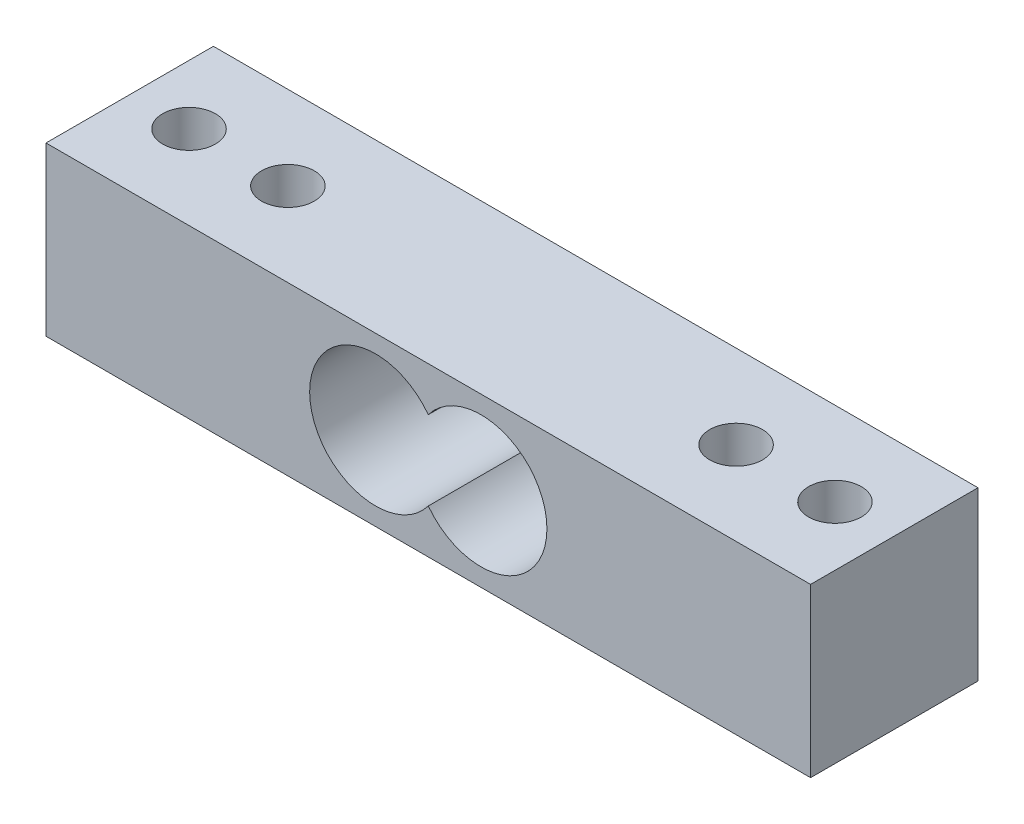
from build123d import *

# Parameters (mm, degrees)
SKIZZE1_W                       = 58
SKIZZE1_H                       = 12.7
SKIZZE1_R                       = 2
AUFSATZ_LINEAR_AUSTRAGEN1_DEPTH = 12.7
SKIZZE2_R                       = 5
SCHNITT_LINEAR_AUSTRAGEN1_DEPTH = 12.7


with BuildPart() as part:
    # Skizze1 → Aufsatz-Linear austragen1 (new body)
    with BuildSketch(Plane(origin=(0, 0, 0), x_dir=(1, 0, 0), z_dir=(0, 1, 0))):
        Rectangle(SKIZZE1_W, SKIZZE1_H)
        with Locations(Location((-24.5, 0, 0), (0, 0, 270))):
            Circle(SKIZZE1_R, mode=Mode.SUBTRACT)
        with Locations(Location((-17, 0, 0), (0, 0, 270))):
            Circle(SKIZZE1_R, mode=Mode.SUBTRACT)
        with Locations(Location((24.5, 0, 0), (0, 0, 270))):
            Circle(SKIZZE1_R, mode=Mode.SUBTRACT)
        with Locations(Location((17, 0, 0), (0, 0, 270))):
            Circle(SKIZZE1_R, mode=Mode.SUBTRACT)
    extrude(amount=AUFSATZ_LINEAR_AUSTRAGEN1_DEPTH)

    # Skizze2 → Schnitt-Linear austragen1 (cut)
    with BuildSketch(Plane.XY.offset(6.35)):
        with Locations((-4, 6.35)):
            Circle(SKIZZE2_R)
        with Locations((4, 6.35)):
            Circle(SKIZZE2_R)
    extrude(amount=-SCHNITT_LINEAR_AUSTRAGEN1_DEPTH, mode=Mode.SUBTRACT)


solid = part.part
